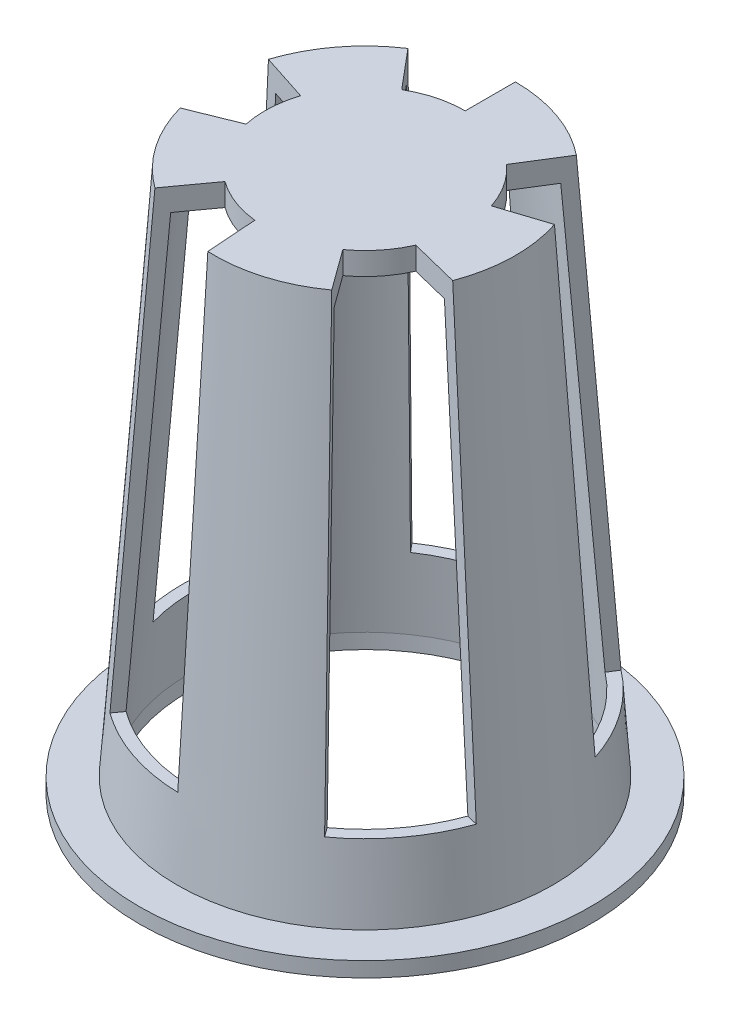
from build123d import *

# Parameters (mm, degrees)
SKETCH6_R           = 20
SKETCH4_R           = 25
SKETCH8_R           = 18.5
SKETCH7_R           = 23.5
SKETCH9_R           = 30
BOSS_EXTRUDE1_DEPTH = 2
SKETCH10_R          = 23.5
CUT_EXTRUDE2_DEPTH  = 2
CUT_EXTRUDE4_DEPTH  = 60


with BuildPart() as part:
    # Sketch6 → Loft1 section 0
    with BuildSketch(Plane(origin=(0, 70, 0), x_dir=(1, 0, 0), z_dir=(0, 1, 0))):
        Circle(SKETCH6_R)
    # Sketch4 → Loft1 section 1
    with BuildSketch(Plane(origin=(0, 0, 0), x_dir=(1, 0, 0), z_dir=(0, 1, 0))):
        Circle(SKETCH4_R)
    loft()

    # Sketch8 → Cut-Loft2 section 0
    with BuildSketch(Plane(origin=(0, 67, 0), x_dir=(1, 0, 0), z_dir=(0, 1, 0))):
        Circle(SKETCH8_R)
    # Sketch7 → Cut-Loft2 section 1
    with BuildSketch(Plane.XZ):
        Circle(SKETCH7_R)
    loft(mode=Mode.SUBTRACT)

    # Sketch9 → Boss-Extrude1 (add)
    with BuildSketch(Plane(origin=(0, 0, 0), x_dir=(1, 0, 0), z_dir=(0, 1, 0))):
        with Locations(Location((0, 0, 0), (0, 0, 270))):
            Circle(SKETCH9_R)
    extrude(amount=-BOSS_EXTRUDE1_DEPTH)

    # Sketch10 → Cut-Extrude2 (cut)
    with BuildSketch(Plane.XZ.offset(2)):
        with Locations(Location((0, 0, 0), (0, 0, 270))):
            Circle(SKETCH10_R)
    extrude(amount=-CUT_EXTRUDE2_DEPTH, mode=Mode.SUBTRACT)

    # Sketch11 → Cut-Extrude4 (cut)
    with BuildSketch(Plane(origin=(0, 70, 0), x_dir=(1, 0, 0), z_dir=(0, 1, 0))):
        with BuildLine():
            Line((0, 13.334004414), (0, 25))
            ThreePointArc((0, 25), (-7.452245669, 23.86344557), (-14.226900712, 20.557122759))
            Line((-14.226900712, 20.557122759), (-6.667002207, 11.547586557))
            ThreePointArc((-6.667002207, 11.547586557), (-3.45109429, 12.879659232), (0, 13.334004414))
        make_face()
        with BuildLine():
            Line((12.681391787, 4.120433967), (23.776412907, 7.725424859))
            ThreePointArc((23.776412907, 7.725424859), (20.392614853, 14.46171703), (15.154631459, 19.883086917))
            Line((15.154631459, 19.883086917), (8.922190459, 9.909096384))
            ThreePointArc((8.922190459, 9.909096384), (11.182837055, 7.262219297), (12.681391787, 4.120433967))
        make_face()
        with BuildLine():
            Line((7.837531149, -10.787436174), (14.694631307, -20.225424859))
            ThreePointArc((14.694631307, -20.225424859), (20.055574767, -14.92561291), (23.59297804, -8.268699244))
            Line((23.59297804, -8.268699244), (12.181219165, -5.423428194))
            ThreePointArc((12.181219165, -5.423428194), (10.362467681, -8.391360872), (7.837531149, -10.787436174))
        make_face()
        with BuildLine():
            Line((-7.837531149, -10.787436174), (-14.694631307, -20.225424859))
            ThreePointArc((-14.694631307, -20.225424859), (-7.997587983, -23.686253111), (-0.573369135, -24.993424092))
            Line((-0.573369135, -24.993424092), (-1.393782991, -13.260959343))
            ThreePointArc((-1.393782991, -13.260959343), (-4.778479821, -12.448365528), (-7.837531149, -10.787436174))
        make_face()
        with BuildLine():
            Line((-12.681391787, 4.120433967), (-23.776412907, 7.725424859))
            ThreePointArc((-23.776412907, 7.725424859), (-24.998355969, 0.286703421), (-23.947339654, -7.17808634))
            Line((-23.947339654, -7.17808634), (-13.042624426, -2.772295403))
            ThreePointArc((-13.042624426, -2.772295403), (-13.315730625, 0.697847872), (-12.681391787, 4.120433967))
        make_face()
    extrude(amount=-CUT_EXTRUDE4_DEPTH, mode=Mode.SUBTRACT)


solid = part.part
